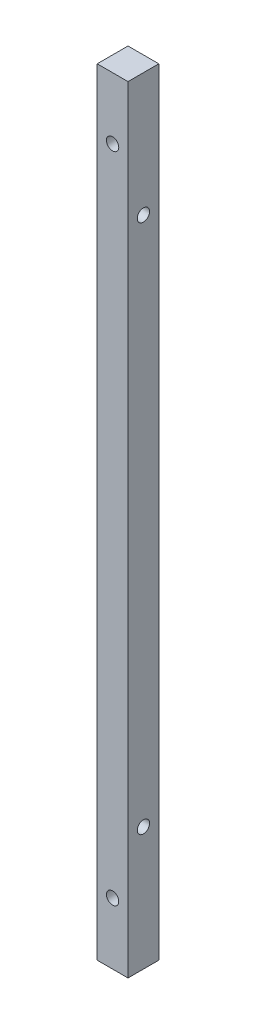
from build123d import *

# Parameters (mm, degrees)
SKETCH_1_W          = 5
SKETCH_1_H          = 126
EXTRUDE_1_DEPTH     = 5
SKETCH_2_R          = 1
CUT_EXTRUDE_1_DEPTH = 5
SKETCH_3_R          = 1
CUT_EXTRUDE_2_DEPTH = 5


with BuildPart() as part:
    # 草图1 → 凸台-拉伸1 (new body)
    with BuildSketch(Plane.XY):
        with Locations((-2.5, 63)):
            Rectangle(SKETCH_1_W, SKETCH_1_H)
    extrude(amount=EXTRUDE_1_DEPTH)

    # 草图2 → 切除-拉伸1 (cut)
    with BuildSketch(Plane.XY.offset(5)):
        with Locations((-2.5, 116)):
            Circle(SKETCH_2_R)
        with Locations((-2.5, 10)):
            Circle(SKETCH_2_R)
    extrude(amount=-CUT_EXTRUDE_1_DEPTH, mode=Mode.SUBTRACT)

    # 草图3 → 切除-拉伸2 (cut)
    with BuildSketch(Plane(origin=(0, 0, 0), x_dir=(0, 0, -1), z_dir=(1, 0, 0))):
        with Locations((-2.5, 106)):
            Circle(SKETCH_3_R)
        with Locations((-2.5, 20)):
            Circle(SKETCH_3_R)
    extrude(amount=-CUT_EXTRUDE_2_DEPTH, mode=Mode.SUBTRACT)


solid = part.part
